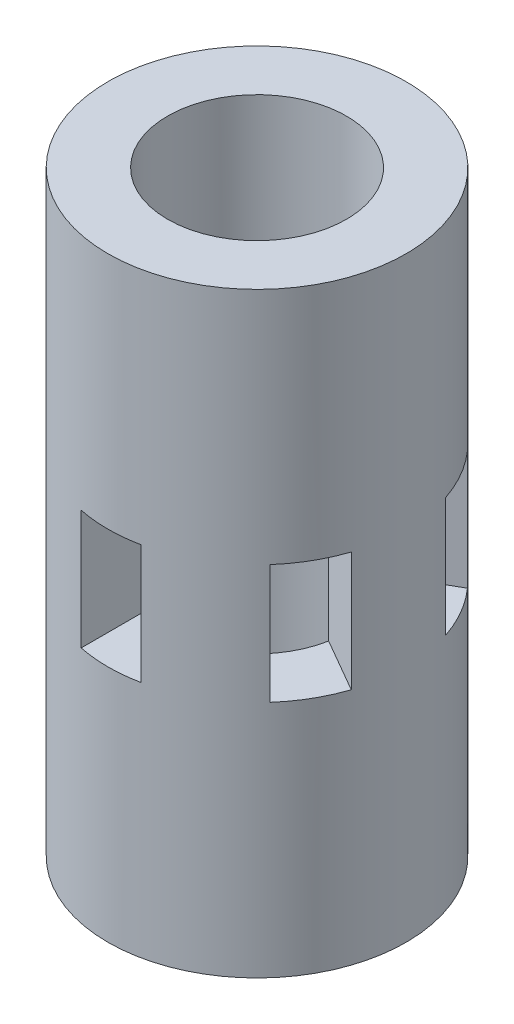
from build123d import *

# Parameters (mm, degrees)
SKETCH1_W               = 10
SKETCH1_H               = 100
CUT_EXTRUDE1_REACH      = 63.237
CUT_EXTRUDE1_END_RADIUS = 25
SKETCH2_W               = 10
SKETCH2_H               = 20
CIRPATTERN1_COUNT       = 6


with BuildPart() as part:
    # Sketch1 → Revolve1 (revolve)
    with BuildSketch(Plane.XY, mode=Mode.PRIVATE) as revolve1_sk:
        with Locations((-20, 0)):
            Rectangle(SKETCH1_W, SKETCH1_H)
    revolve(revolve1_sk.sketch.rotate(Axis((0, 56.451612903, 0), (0, -1, 0)), 270), axis=Axis((0, 56.451612903, 0), (0, -1, 0)))

    # Cut-Extrude1: up to this cylinder (the profile starts inside it)
    cut_extrude1_end = Plane(origin=(0, 0, 0), z_dir=(0, 1, 0)) * Cylinder(CUT_EXTRUDE1_END_RADIUS, 177.474, mode=Mode.PRIVATE)
    # Sketch2 → Cut-Extrude1 (cut, up to the surface)
    with BuildSketch(Plane.XY, mode=Mode.PRIVATE) as cut_extrude1_sk1:
        Rectangle(SKETCH2_W, SKETCH2_H)
    cut_extrude1_tool1 = extrude(cut_extrude1_sk1.sketch, amount=-CUT_EXTRUDE1_REACH, mode=Mode.PRIVATE) & cut_extrude1_end
    cut_extrude1 = cut_extrude1_tool1.solids().sort_by_distance((0, 0, 0))[0]
    add(cut_extrude1, mode=Mode.SUBTRACT)

    # CirPattern1: Cut-Extrude1 ×6 about axis
    cirpattern1_axis = Axis((0, 0, 0), (0, 1, 0))
    for i in range(1, CIRPATTERN1_COUNT):
        add(cut_extrude1.rotate(cirpattern1_axis, i * 360 / CIRPATTERN1_COUNT), mode=Mode.SUBTRACT)


solid = part.part
